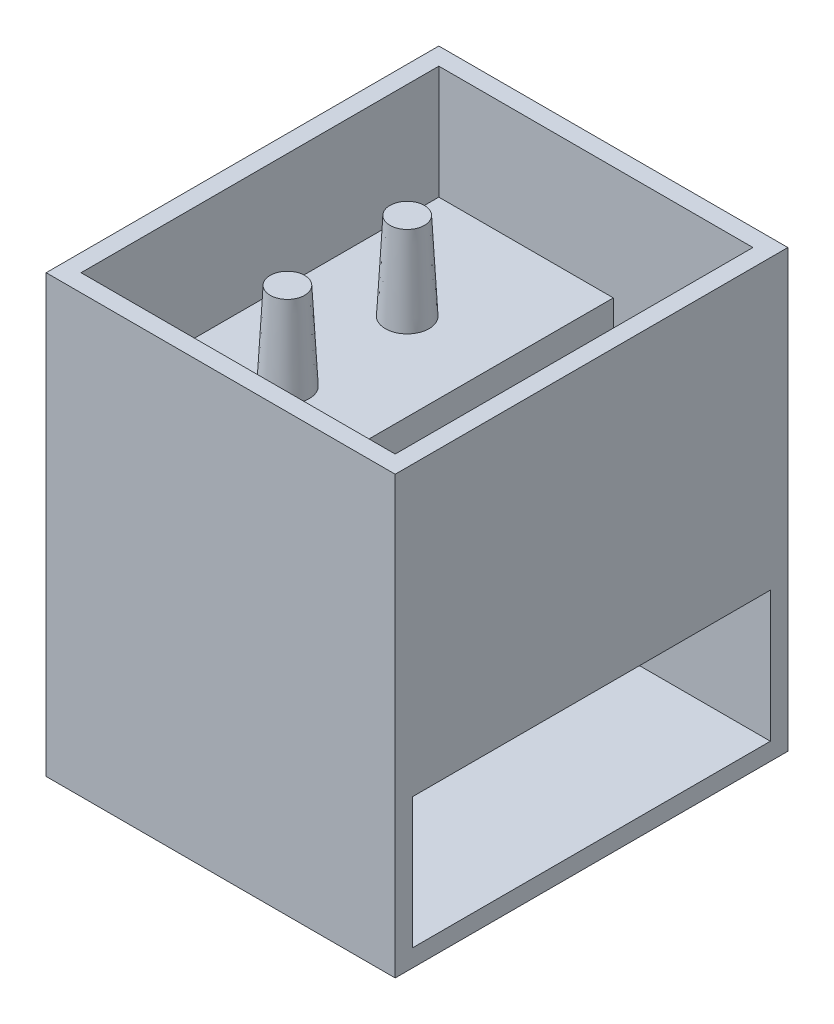
from build123d import *

# Parameters (mm, degrees)
SKETCH1_W           = 40
SKETCH1_H           = 45
BOSS_EXTRUDE1_DEPTH = 50
SHELL1_T            = -2
SKETCH2_W           = 41
SKETCH2_H           = 15
CUT_EXTRUDE1_DEPTH  = 3
SKETCH4_W           = 41
SKETCH4_H           = 10
BOSS_EXTRUDE2_DEPTH = 20
SKETCH17_R          = 2.5
BOSS_EXTRUDE3_DEPTH = 10
BOSS_EXTRUDE3_TAPER = 3
SKETCH16_R          = 2.5
BOSS_EXTRUDE4_DEPTH = 10
BOSS_EXTRUDE4_TAPER = 3


with BuildPart() as part:
    # Sketch1 → Boss-Extrude1 (new body)
    with BuildSketch(Plane(origin=(0, 0, 0), x_dir=(1, 0, 0), z_dir=(0, 1, 0))):
        with Locations((-14.888700463, -8.449653636)):
            Rectangle(SKETCH1_W, SKETCH1_H)
    extrude(amount=BOSS_EXTRUDE1_DEPTH)

    # Shell1
    shell1_openings = [part.faces().sort_by_distance(p)[0] for p in [
        (-14.888700463, 50, 8.449653636),
    ]]
    offset(amount=SHELL1_T, openings=shell1_openings, kind=Kind.INTERSECTION)

    # Sketch2 → Cut-Extrude1 (cut)
    with BuildSketch(Plane.ZY.offset(-3.111299537)):
        with Locations((8.449653636, 9.5)):
            Rectangle(SKETCH2_W, SKETCH2_H)
    extrude(amount=-CUT_EXTRUDE1_DEPTH, mode=Mode.SUBTRACT)

    # Sketch4 → Boss-Extrude2 (add)
    with BuildSketch(Plane(origin=(-32.888700463, 0, 0), x_dir=(0, 0, -1), z_dir=(1, 0, 0))):
        with Locations((-8.449653636, 32)):
            Rectangle(SKETCH4_W, SKETCH4_H)
    extrude(amount=BOSS_EXTRUDE2_DEPTH)

    # Sketch17 → Boss-Extrude3 (add)
    with BuildSketch(Plane(origin=(0, 37, 0), x_dir=(1, 0, 0), z_dir=(0, 1, 0))):
        with Locations((-22.888700463, -1.572936471)):
            Circle(SKETCH17_R)
    extrude(amount=BOSS_EXTRUDE3_DEPTH, taper=BOSS_EXTRUDE3_TAPER)

    # Sketch16 → Boss-Extrude4 (add)
    with BuildSketch(Plane(origin=(0, 37, 0), x_dir=(1, 0, 0), z_dir=(0, 1, 0))):
        with Locations((-22.81018082, -15.377942678)):
            Circle(SKETCH16_R)
    extrude(amount=BOSS_EXTRUDE4_DEPTH, taper=BOSS_EXTRUDE4_TAPER)


solid = part.part
